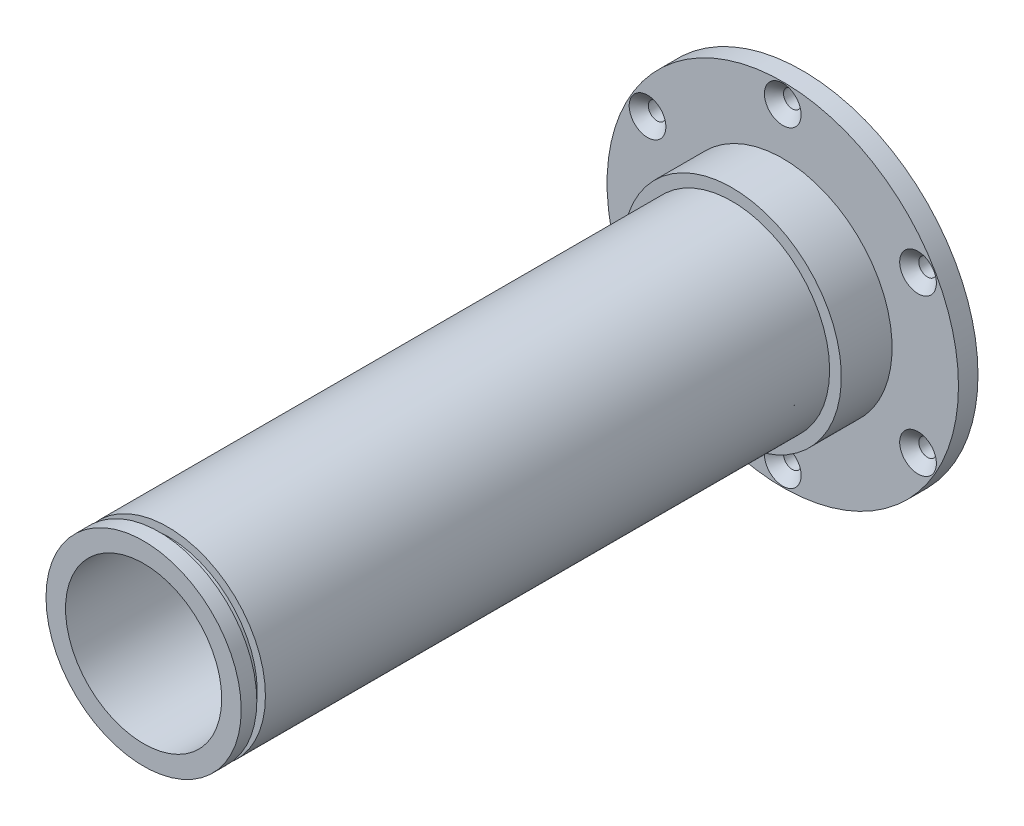
from build123d import *

# Parameters (mm, degrees)
SKETCH1_R                                       = 45
SKETCH1_R_2                                     = 2
EXTRUDE1_DEPTH                                  = 5
SKETCH2_R                                       = 28
EXTRUDE2_DEPTH                                  = 13
SKETCH3_R                                       = 25
EXTRUDE3_DEPTH                                  = 150.7
SKETCH4_R                                       = 20
CUT_EXTRUDE1_DEPTH                              = 200
CUT_EXTRUDE2_START                              = -6.2
SKETCH5_R                                       = 25
SKETCH5_R_2                                     = 22.9
CUT_EXTRUDE2_DEPTH                              = 2.2
BOSS_EXTRUDE1_START                             = 3
SKETCH6_R                                       = 25
SKETCH6_R_2                                     = 20
BOSS_EXTRUDE1_DEPTH                             = 3
CSK_FOR_M4_FLAT_HEAD_MACHINE_SCREW1_D           = 4.5
CSK_FOR_M4_FLAT_HEAD_MACHINE_SCREW1_CSINK_D     = 9.4
CSK_FOR_M4_FLAT_HEAD_MACHINE_SCREW1_CSINK_ANGLE = 90


with BuildPart() as part:
    # Sketch1 → Extrude1 (new body)
    with BuildSketch(Plane.XY):
        Circle(SKETCH1_R)
        with Locations((-34.641016151, -20)):
            Circle(SKETCH1_R_2, mode=Mode.SUBTRACT)
        with Locations((-34.641016151, 20)):
            Circle(SKETCH1_R_2, mode=Mode.SUBTRACT)
        with Locations((0, 40)):
            Circle(SKETCH1_R_2, mode=Mode.SUBTRACT)
        with Locations((0, -40)):
            Circle(SKETCH1_R_2, mode=Mode.SUBTRACT)
        with Locations((34.641016151, 20)):
            Circle(SKETCH1_R_2, mode=Mode.SUBTRACT)
        with Locations((34.641016151, -20)):
            Circle(SKETCH1_R_2, mode=Mode.SUBTRACT)
    extrude(amount=EXTRUDE1_DEPTH)

    # Sketch2 → Extrude2 (add)
    with BuildSketch(Plane.XY.offset(5)):
        with Locations(Location((0, 0, 0), (0, 0, 180))):
            Circle(SKETCH2_R)
    extrude(amount=EXTRUDE2_DEPTH)

    # Sketch3 → Extrude3 (add)
    with BuildSketch(Plane.XY.offset(18)):
        Circle(SKETCH3_R)
    extrude(amount=EXTRUDE3_DEPTH)

    # Sketch4 → Cut-Extrude1 (cut)
    with BuildSketch(Plane.XY.offset(168.7)):
        Circle(SKETCH4_R)
    extrude(amount=-CUT_EXTRUDE1_DEPTH, mode=Mode.SUBTRACT)

    # Sketch5 → Cut-Extrude2 (cut)
    with BuildSketch(Plane.XY.offset(168.7).offset(CUT_EXTRUDE2_START)):
        Circle(SKETCH5_R)
        Circle(SKETCH5_R_2, mode=Mode.SUBTRACT)
    extrude(amount=CUT_EXTRUDE2_DEPTH, mode=Mode.SUBTRACT)

    # Sketch6 → Boss-Extrude1 (add)
    with BuildSketch(Plane(origin=(0, 0, 0), x_dir=(-1, 0, 0), z_dir=(0, 0, -1)).offset(BOSS_EXTRUDE1_START)):
        with Locations(Location((0, 0, 0), (0, 0, 180))):
            Circle(SKETCH6_R)
        with Locations(Location((0, 0, 0), (0, 0, 180))):
            Circle(SKETCH6_R_2, mode=Mode.SUBTRACT)
    extrude(amount=-BOSS_EXTRUDE1_DEPTH)

    # CSK for M4 Flat Head Machine Screw1 (through all)
    with Locations(Plane.XY.offset(5)):
        with Locations((34.641016151, -20), (0, -40), (-34.641016151, -20), (-34.641016151, 20), (0, 40), (34.641016151, 20)):
            CounterSinkHole(CSK_FOR_M4_FLAT_HEAD_MACHINE_SCREW1_D / 2, CSK_FOR_M4_FLAT_HEAD_MACHINE_SCREW1_CSINK_D / 2, counter_sink_angle=CSK_FOR_M4_FLAT_HEAD_MACHINE_SCREW1_CSINK_ANGLE)


solid = part.part
